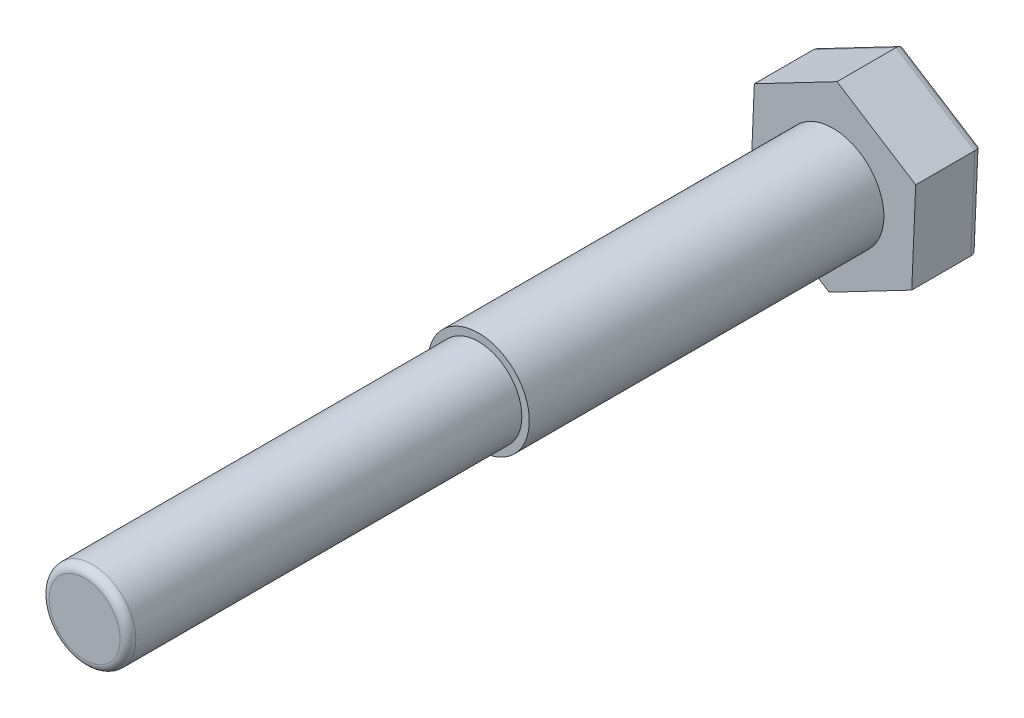
from build123d import *

# Parameters (mm, degrees)
EXTRUDE_302_DEPTH = 17
SKETCH_2_R        = 12.9
EXTRUDE_1_DEPTH   = 90
FILLET_3_R        = 2
SKETCH_3_R        = 11
EXTRUDE_2_DEPTH   = 100
FILLET_4_R        = 2


with BuildPart() as part:
    # 草图1 → Extrude 302 (new body)
    with BuildSketch(Plane.XY):
        Polygon((20.984201837, 10.954296262), (1.005402075, 23.65), (-19.978799762, 12.695703738), (-20.984201837, -10.954296262), (-1.005402075, -23.65), (19.978799762, -12.695703738), align=None)
    extrude(amount=EXTRUDE_302_DEPTH)

    # 草图2 → 凸台-拉伸1 (add)
    with BuildSketch(Plane.XY.offset(17)):
        with Locations(Location((0, 0, 0), (0, 0, 180))):
            Circle(SKETCH_2_R)
    extrude(amount=EXTRUDE_1_DEPTH)

    # 圆角3
    fillet_3_edges = [part.edges().sort_by_distance(p)[0] for p in [
        (9.486698843, -18.172851869, 0),
        (-10.994801956, -17.302148131, 0),
        (-20.4815008, 0.870703738, 0),
        (-9.486698843, 18.172851869, 0),
        (10.994801956, 17.302148131, 0),
        (20.4815008, -0.870703738, 0),
    ]]
    fillet(fillet_3_edges, radius=FILLET_3_R)

    # 草图3 → 凸台-拉伸2 (add)
    with BuildSketch(Plane.XY.offset(107)):
        Circle(SKETCH_3_R)
    extrude(amount=EXTRUDE_2_DEPTH)

    # 圆角4
    fillet_4_edges = [part.edges().sort_by_distance(p)[0] for p in [
        (-11, 0, 207),
    ]]
    fillet(fillet_4_edges, radius=FILLET_4_R)


solid = part.part
